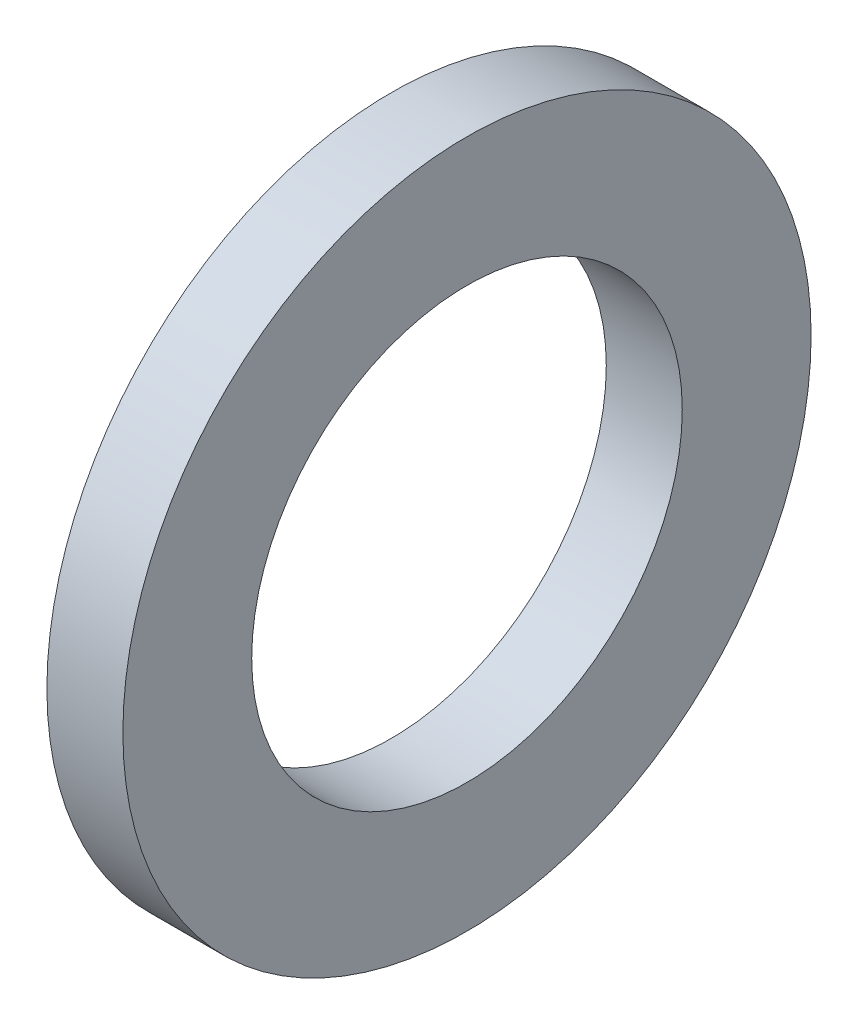
from build123d import *

# Parameters (mm, degrees)
SKETCH1_R           = 7.9375
SKETCH1_R_2         = 4.9657
BOSS_EXTRUDE1_DEPTH = 1.7526


with BuildPart() as part:
    # Sketch1 → Boss-Extrude1 (new body)
    with BuildSketch(Plane(origin=(0, 0, 0), x_dir=(0, 0, -1), z_dir=(1, 0, 0))):
        Circle(SKETCH1_R)
        Circle(SKETCH1_R_2, mode=Mode.SUBTRACT)
    extrude(amount=BOSS_EXTRUDE1_DEPTH)


solid = part.part
